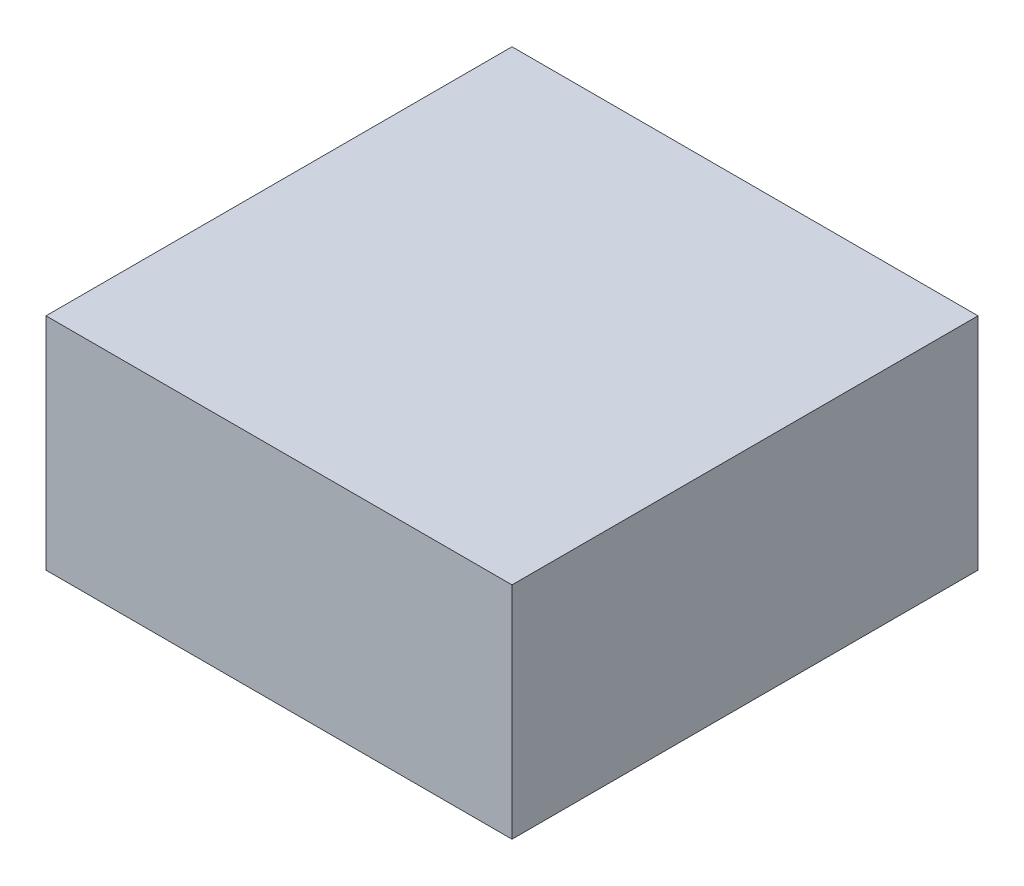
from build123d import *

# Parameters (mm, degrees)
SKETCH1_W           = 550
SKETCH1_H           = 550
BOSS_EXTRUDE1_DEPTH = 260


with BuildPart() as part:
    # Sketch1 → Boss-Extrude1 (new body)
    with BuildSketch(Plane(origin=(0, 0, 0), x_dir=(1, 0, 0), z_dir=(0, 1, 0))):
        Rectangle(SKETCH1_W, SKETCH1_H)
    extrude(amount=BOSS_EXTRUDE1_DEPTH)


solid = part.part
